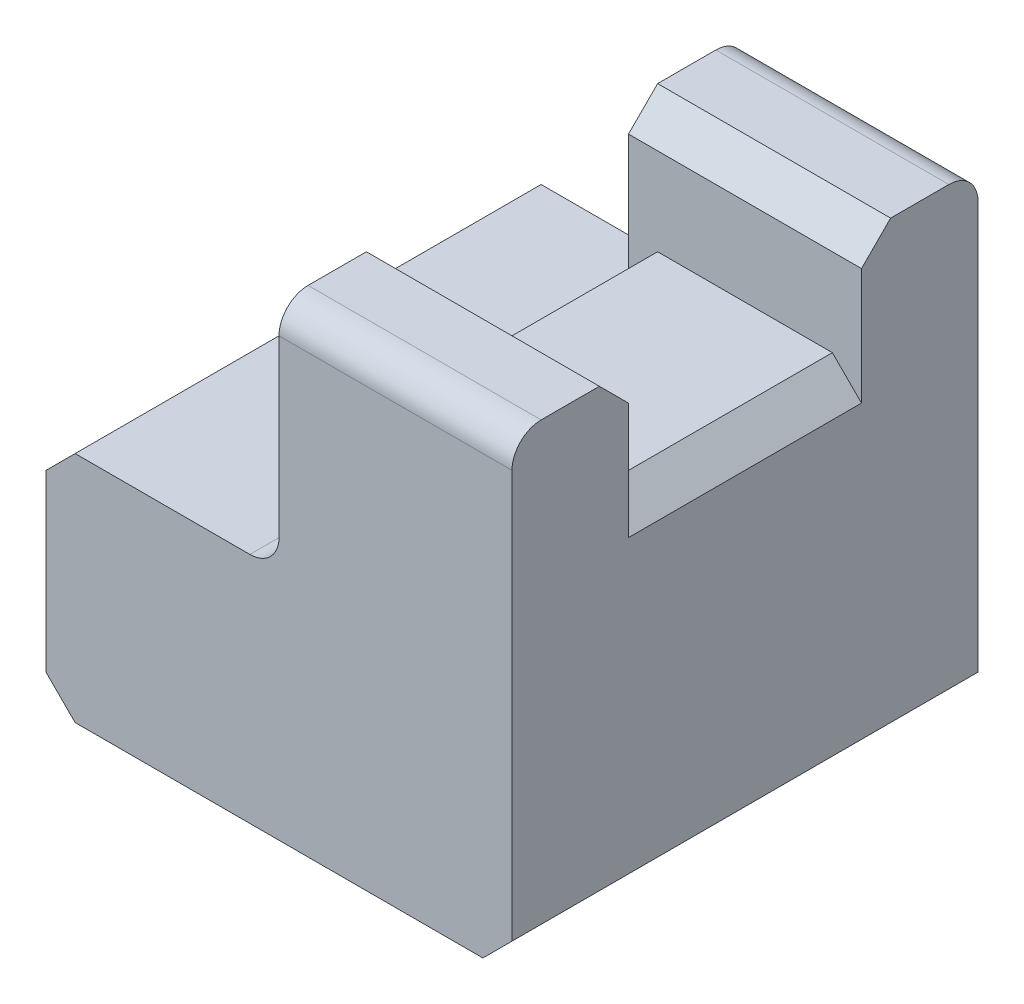
from build123d import *

# Parameters (mm, degrees)
BOSS_EXTRUDE1_DEPTH = 80
SKETCH3_W           = 40
SKETCH3_H           = 20
CUT_EXTRUDE1_DEPTH  = 139.564064606
FILLET1_R           = 5
CHAMFER1_SIZE       = 5
SKETCH4_R           = 10
CUT_EXTRUDE2_DEPTH  = 121
CHAMFER2_SIZE       = 5
FILLET2_R           = 5
CHAMFER3_SIZE       = 5
CHAMFER4_SIZE       = 5
CHAMFER5_SIZE       = 5
CHAMFER6_SIZE       = 5


with BuildPart() as part:
    # Sketch1 → Boss-Extrude1 (new body)
    with BuildSketch(Plane.XY):
        Polygon((0, 0), (-80, 0), (-80, 40), (-40, 40), (-40, 80), (0, 80), align=None)
    extrude(amount=BOSS_EXTRUDE1_DEPTH)

    # Sketch3 → Cut-Extrude1 (cut, through all)
    with BuildSketch(Plane(origin=(0, 0, 0), x_dir=(0, 0, -1), z_dir=(1, 0, 0))):
        with Locations((-40, 70)):
            Rectangle(SKETCH3_W, SKETCH3_H)
    extrude(amount=-CUT_EXTRUDE1_DEPTH, mode=Mode.SUBTRACT)

    # Fillet1
    fillet1_edges = [part.edges().sort_by_distance(p)[0] for p in [
        (-20, 80, 80),
        (-20, 80, 0),
    ]]
    fillet(fillet1_edges, radius=FILLET1_R)

    # Chamfer1
    chamfer1_edges = [part.edges().sort_by_distance(p)[0] for p in [
        (-20, 80, 60),
        (-20, 80, 20),
    ]]
    chamfer(chamfer1_edges, length=CHAMFER1_SIZE)

    # Sketch4 → Cut-Extrude2 (cut, through all)
    with BuildSketch(Plane(origin=(0, 40, 0), x_dir=(1, 0, 0), z_dir=(0, 1, 0))):
        with Locations(Location((-60, -40, 0), (0, 0, 270))):
            Circle(SKETCH4_R)
    extrude(amount=-CUT_EXTRUDE2_DEPTH, mode=Mode.SUBTRACT)

    # Chamfer2
    chamfer2_edges = [part.edges().sort_by_distance(p)[0] for p in [
        (-80, 40, 40),
    ]]
    chamfer(chamfer2_edges, length=CHAMFER2_SIZE)

    # Fillet2
    fillet2_edges = [part.edges().sort_by_distance(p)[0] for p in [
        (-40, 40, 40),
    ]]
    fillet(fillet2_edges, radius=FILLET2_R)

    # Chamfer3
    chamfer3_edges = [part.edges().sort_by_distance(p)[0] for p in [
        (-80, 0, 40),
    ]]
    chamfer(chamfer3_edges, length=CHAMFER3_SIZE)

    # Chamfer4
    chamfer4_edges = [part.edges().sort_by_distance(p)[0] for p in [
        (0, 0, 40),
    ]]
    chamfer(chamfer4_edges, length=CHAMFER4_SIZE)

    # Chamfer5
    chamfer5_edges = [part.edges().sort_by_distance(p)[0] for p in [
        (0, 60, 40),
    ]]
    chamfer(chamfer5_edges, length=CHAMFER5_SIZE)

    # Chamfer6
    chamfer6_edges = [part.edges().sort_by_distance(p)[0] for p in [
        (-40, 60, 40),
    ]]
    chamfer(chamfer6_edges, length=CHAMFER6_SIZE)


solid = part.part
